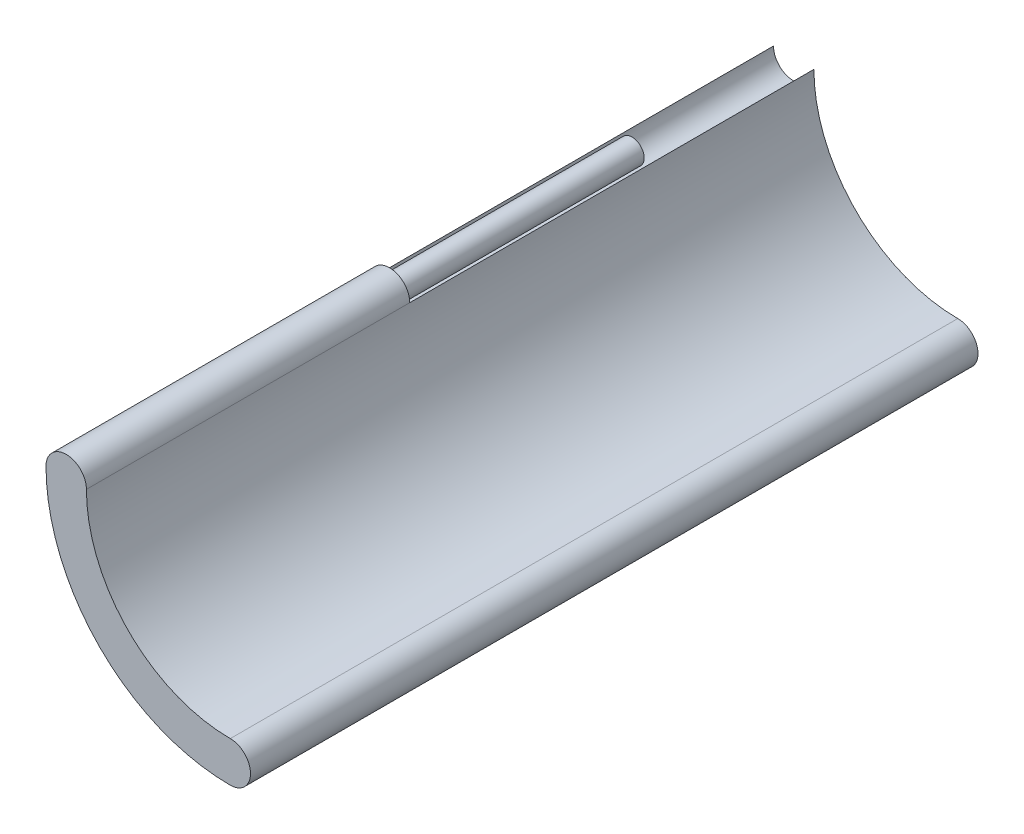
from build123d import *

# Parameters (mm, degrees)
BOSS_EXTRU_1_DEPTH = 450
ESQUISSE1_3_R      = 7.5
BOSS_EXTRU_2_DEPTH = 350
ESQUISSE1_4_R      = 7.5
BOSS_EXTRU_3_DEPTH = 200


with BuildPart() as part:
    # Esquisse1 → Boss.-Extru.1 (new body)
    with BuildSketch(Plane.XY):
        with BuildLine():
            ThreePointArc((-6e-09, -89), (-62.932503528, -62.932503523), (-89, 0))
            ThreePointArc((-89, 0), (-101.500000043, -12.5), (-114, 8.5e-08))
            ThreePointArc((-114, 8.5e-08), (-80.610173059, -80.610173051), (7.4e-08, -114))
            ThreePointArc((7.4e-08, -114), (12.5, -101.49999996), (-6e-09, -89))
        make_face()
    extrude(amount=-BOSS_EXTRU_1_DEPTH)



with BuildPart() as body_2:
    # Esquisse1<3> → Boss.-Extru.2 (new body)
    with BuildSketch(Plane.XY):
        with Locations((-101.5, 0)):
            Circle(ESQUISSE1_3_R)
    extrude(amount=-BOSS_EXTRU_2_DEPTH)


with BuildPart() as part_1:
    add(part.part)

    add(body_2.part)  # Boss.-Extru.3 merges body 2
    # Esquisse1<4> → Boss.-Extru.3 (add)
    with BuildSketch(Plane.XY):
        with BuildLine():
            ThreePointArc((-114, 8.5e-08), (-101.500000043, -12.5), (-89, 0))
            ThreePointArc((-89, 0), (-101.499999957, 12.5), (-114, 8.5e-08))
        make_face()
        with Locations((-101.5, 0)):
            Circle(ESQUISSE1_4_R, mode=Mode.SUBTRACT)
    extrude(amount=-BOSS_EXTRU_3_DEPTH)


solid = part_1.part
